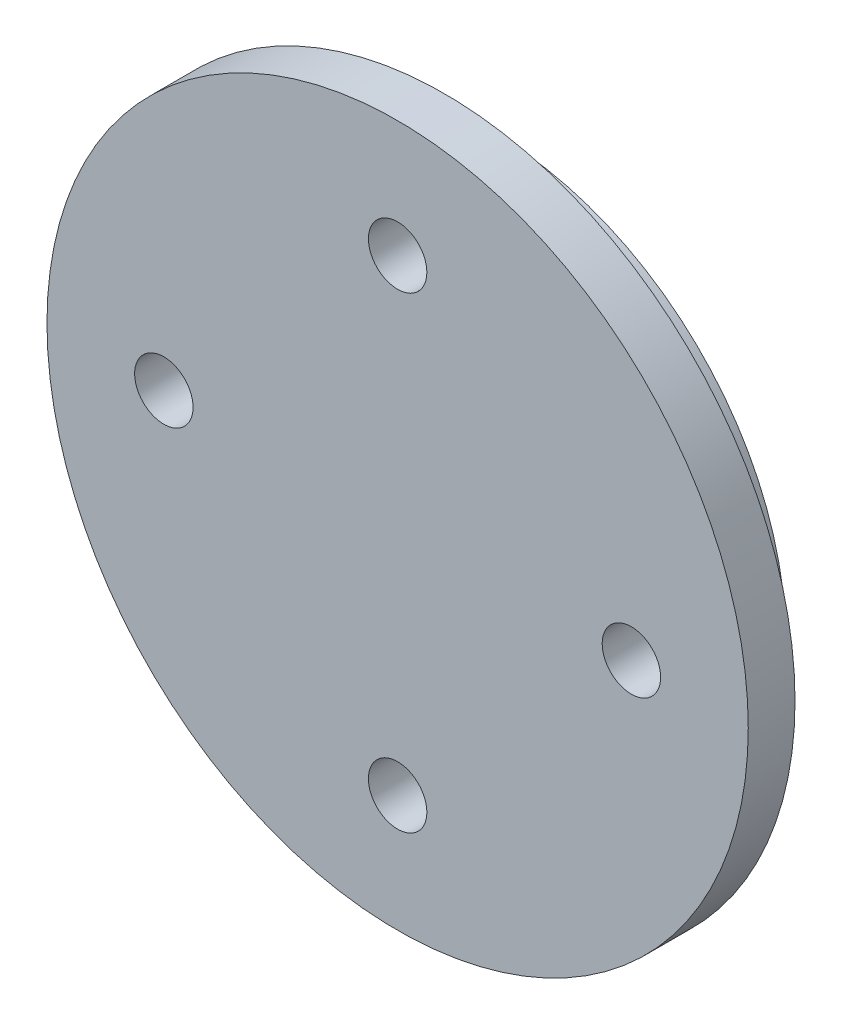
from build123d import *

# Parameters (mm, degrees)
SKETCH1_R           = 31.75
BOSS_EXTRUDE1_DEPTH = 5.334
SKETCH2_R           = 38.1
BOSS_EXTRUDE2_DEPTH = 5.08
SKETCH3_R           = 3.175
CUT_EXTRUDE1_DEPTH  = 55.878697106
CIRPATTERN1_COUNT   = 4
SKETCH6_R           = 1.27
CUT_EXTRUDE3_DEPTH  = 5.334
CIRPATTERN2_COUNT   = 4


with BuildPart() as part:
    # Sketch1 → Boss-Extrude1 (new body)
    with BuildSketch(Plane.XY):
        Circle(SKETCH1_R)
    extrude(amount=BOSS_EXTRUDE1_DEPTH)

    # Sketch2 → Boss-Extrude2 (add)
    with BuildSketch(Plane.XY.offset(5.334)):
        Circle(SKETCH2_R)
    extrude(amount=BOSS_EXTRUDE2_DEPTH)

    # Sketch3 → Cut-Extrude1 (cut, through all)
    with BuildSketch(Plane.XY.offset(10.414)):
        with Locations((0, 25.4)):
            Circle(SKETCH3_R)
    cut_extrude1 = extrude(amount=-CUT_EXTRUDE1_DEPTH, mode=Mode.SUBTRACT)

    # CirPattern1: Cut-Extrude1 ×4 about axis
    cirpattern1_axis = Axis((0, 0, 0), (0, 0, 1))
    for i in range(1, CIRPATTERN1_COUNT):
        add(cut_extrude1.rotate(cirpattern1_axis, i * 360 / CIRPATTERN1_COUNT), mode=Mode.SUBTRACT)

    # Sketch6 → Cut-Extrude3 (cut)
    with BuildSketch(Plane(origin=(0, 0, 0), x_dir=(-1, 0, 0), z_dir=(0, 0, -1))):
        with Locations((-5.08, 0)):
            Circle(SKETCH6_R)
    cut_extrude3 = extrude(amount=-CUT_EXTRUDE3_DEPTH, mode=Mode.SUBTRACT)

    # CirPattern2: Cut-Extrude3 ×4 about axis
    cirpattern2_axis = Axis((0, 0, 0), (0, 0, 1))
    for i in range(1, CIRPATTERN2_COUNT):
        add(cut_extrude3.rotate(cirpattern2_axis, i * 360 / CIRPATTERN2_COUNT), mode=Mode.SUBTRACT)


solid = part.part
